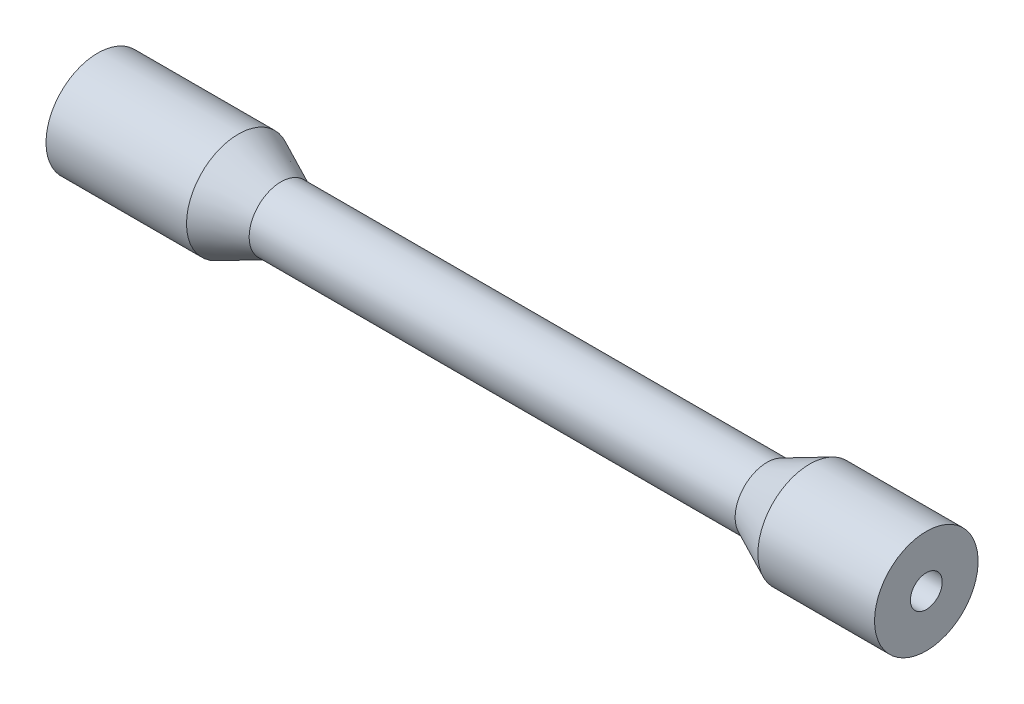
from build123d import *

# Parameters (mm, degrees)
SKETCH_1_R      = 3.25
SKETCH_1_R_2    = 1
EXTRUDE_1_DEPTH = 52


with BuildPart() as part:
    # 草图1 → 凸台-拉伸1 (new body)
    with BuildSketch(Plane(origin=(0, 0, 0), x_dir=(0, 0, -1), z_dir=(1, 0, 0))):
        with Locations(Location((0, 0, 0), (0, 0, 180))):
            Circle(SKETCH_1_R)
        with Locations(Location((0, 0, 0), (0, 0, 180))):
            Circle(SKETCH_1_R_2, mode=Mode.SUBTRACT)
    extrude(amount=EXTRUDE_1_DEPTH)

    # 草图3 → 切除-旋转1 (revolve, cut)
    with BuildSketch(Plane.XY, mode=Mode.PRIVATE) as cut_revolve_1_sk:
        Polygon((8.819366349, 3.25), (11.5, 2), (42, 2), (44.680633651, 3.25), align=None)
    revolve(cut_revolve_1_sk.sketch.rotate(Axis((0, 0, 0), (1, 0, 0)), 90), axis=Axis((0, 0, 0), (1, 0, 0)), mode=Mode.SUBTRACT)


solid = part.part
